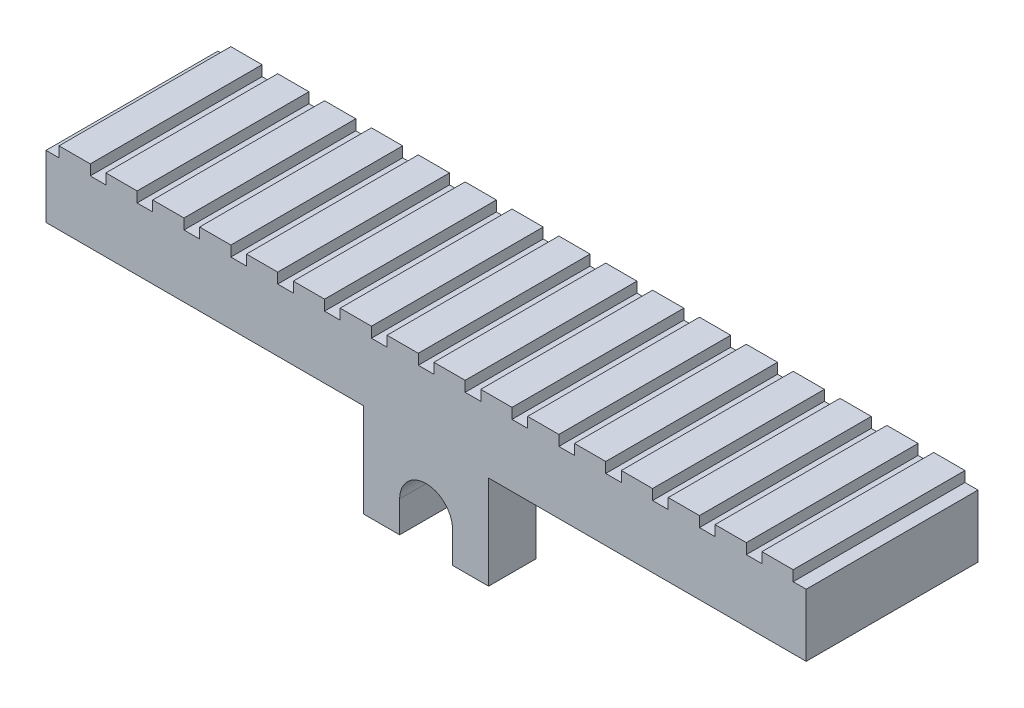
from build123d import *

# Parameters (mm, degrees)
SKETCH4_W            = 73
SKETCH4_H            = 15
BOSS_EXTRUDE4_DEPTH  = 6
SKETCH15_W           = 3
SKETCH15_H           = 15
BOSS_EXTRUDE6_DEPTH  = 1
BOSS_EXTRUDE7_DEPTH  = 1.5
BOSS_EXTRUDE13_DEPTH = 7.715
CUT_EXTRUDE2_REACH   = 40.656
SKETCH22_W           = 12
SKETCH22_H           = 3.715
CUT_EXTRUDE3_REACH   = 42.428
BOSS_EXTRUDE14_DEPTH = 2.54


with BuildPart() as part:
    # Sketch4 → Boss-Extrude4 (new body)
    with BuildSketch(Plane(origin=(0, 0, 0), x_dir=(-1, 0, 0), z_dir=(0, 1, 0))):
        Rectangle(SKETCH4_W, SKETCH4_H)
    extrude(amount=-BOSS_EXTRUDE4_DEPTH)

    # Sketch15 → Boss-Extrude6 (add)
    with BuildSketch(Plane(origin=(0, 0, 0), x_dir=(1, 0, 0), z_dir=(0, 1, 0))):
        with Locations((2.25, 0)):
            Rectangle(SKETCH15_W, SKETCH15_H)
        with Locations((6.75, 0)):
            Rectangle(SKETCH15_W, SKETCH15_H)
        with Locations((11.25, 0)):
            Rectangle(SKETCH15_W, SKETCH15_H)
        with Locations((15.75, 0)):
            Rectangle(SKETCH15_W, SKETCH15_H)
        with Locations((20.25, 0)):
            Rectangle(SKETCH15_W, SKETCH15_H)
        with Locations((24.75, 0)):
            Rectangle(SKETCH15_W, SKETCH15_H)
        with Locations((29.25, 0)):
            Rectangle(SKETCH15_W, SKETCH15_H)
        with Locations((33.75, 0)):
            Rectangle(SKETCH15_W, SKETCH15_H)
        with Locations((-33.75, 0)):
            Rectangle(SKETCH15_W, SKETCH15_H)
        with Locations((-29.25, 0)):
            Rectangle(SKETCH15_W, SKETCH15_H)
        with Locations((-24.75, 0)):
            Rectangle(SKETCH15_W, SKETCH15_H)
        with Locations((-20.25, 0)):
            Rectangle(SKETCH15_W, SKETCH15_H)
        with Locations((-15.75, 0)):
            Rectangle(SKETCH15_W, SKETCH15_H)
        with Locations((-11.25, 0)):
            Rectangle(SKETCH15_W, SKETCH15_H)
        with Locations((-6.75, 0)):
            Rectangle(SKETCH15_W, SKETCH15_H)
        with Locations((-2.25, 0)):
            Rectangle(SKETCH15_W, SKETCH15_H)
    extrude(amount=BOSS_EXTRUDE6_DEPTH)

    # Sketch16 → Boss-Extrude7 (add)
    with BuildSketch(Plane.XY.offset(7.5)):
        Polygon((-35.25, 0), (-36.5, 0), (-36.5, -6), (36.5, -6), (36.5, 0), (35.25, 0), (35.25, 1), (32.25, 1), (32.25, 0), (30.75, 0), (30.75, 1), (27.75, 1), (27.75, 0), (26.25, 0), (26.25, 1), (23.25, 1), (23.25, 0), (21.75, 0), (21.75, 1), (18.75, 1), (18.75, 0), (17.25, 0), (17.25, 1), (14.25, 1), (14.25, 0), (12.75, 0), (12.75, 1), (9.75, 1), (9.75, 0), (8.25, 0), (8.25, 1), (5.25, 1), (5.25, 0), (3.75, 0), (3.75, 1), (0.75, 1), (0.75, 0), (-0.75, 0), (-0.75, 1), (-3.75, 1), (-3.75, 0), (-5.25, 0), (-5.25, 1), (-8.25, 1), (-8.25, 0), (-9.75, 0), (-9.75, 1), (-12.75, 1), (-12.75, 0), (-14.25, 0), (-14.25, 1), (-17.25, 1), (-17.25, 0), (-18.75, 0), (-18.75, 1), (-21.75, 1), (-21.75, 0), (-23.25, 0), (-23.25, 1), (-26.25, 1), (-26.25, 0), (-27.75, 0), (-27.75, 1), (-30.75, 1), (-30.75, 0), (-32.25, 0), (-32.25, 1), (-35.25, 1), align=None)
    extrude(amount=BOSS_EXTRUDE7_DEPTH)

    # Sketch21 → Boss-Extrude13 (add)
    with BuildSketch(Plane.XY.offset(9)):
        with BuildLine():
            Line((-2.54, -12), (-2.54, -15))
            Line((-2.54, -15), (-6, -15))
            Line((-6, -15), (-6, -6))
            Line((-6, -6), (6, -6))
            Line((6, -6), (6, -15))
            Line((6, -15), (2.54, -15))
            Line((2.54, -15), (2.54, -12))
            ThreePointArc((2.54, -12), (0, -9.46), (-2.54, -12))
        make_face()
    extrude(amount=-BOSS_EXTRUDE13_DEPTH)

    # Cut-Extrude2: up to this face of the body (flat: up to its plane)
    cut_extrude2_end = Plane(part.part.faces().sort_by_distance((4.27, -15, 5.1425))[0])
    # Sketch22 → Cut-Extrude2 (cut, up to the picked face)
    with BuildSketch(Plane.XZ.offset(6), mode=Mode.PRIVATE) as cut_extrude2_sk1:
        with Locations((0, 5.1425)):
            Rectangle(SKETCH22_W, SKETCH22_H)
    cut_extrude2_tool1 = split(extrude(cut_extrude2_sk1.sketch, amount=CUT_EXTRUDE2_REACH, mode=Mode.PRIVATE), bisect_by=cut_extrude2_end, keep=Keep.BOTH, mode=Mode.PRIVATE)
    add(cut_extrude2_tool1.solids().sort_by(Axis((0, -6, 5.1425), (0, -1, 0)))[0], mode=Mode.SUBTRACT)

    # Sketch23 → Cut-Extrude3 (cut, up to next)
    with BuildSketch(Plane(origin=(0, 0, 1.285), x_dir=(-1, 0, 0), z_dir=(0, 0, -1)), mode=Mode.PRIVATE) as cut_extrude3_sk1:
        with BuildLine():
            Line((6, -15), (6, -6))
            Line((6, -6), (-6, -6))
            Line((-6, -6), (-6, -15))
            Line((-6, -15), (-2.54, -15))
            Line((-2.54, -15), (-2.54, -12))
            ThreePointArc((-2.54, -12), (0, -9.46), (2.54, -12))
            Line((2.54, -12), (2.54, -15))
            Line((2.54, -15), (6, -15))
        make_face()
    cut_extrude3_tool1 = extrude(cut_extrude3_sk1.sketch, amount=-CUT_EXTRUDE3_REACH, mode=Mode.PRIVATE) & part.part
    add(cut_extrude3_tool1.solids().sort_by_distance((-5.85, -10.5, 1.285))[0], mode=Mode.SUBTRACT)

    # Sketch24 → Boss-Extrude14 (add)
    with BuildSketch(Plane(origin=(0, 0, 7), x_dir=(-1, 0, 0), z_dir=(0, 0, -1))):
        with BuildLine():
            Line((2.54, -12), (2.54, -15))
            Line((2.54, -15), (6, -15))
            Line((6, -15), (6, -6))
            Line((6, -6), (-6, -6))
            Line((-6, -6), (-6, -15))
            Line((-6, -15), (-2.54, -15))
            Line((-2.54, -15), (-2.54, -12))
            ThreePointArc((-2.54, -12), (0, -9.46), (2.54, -12))
        make_face()
    extrude(amount=BOSS_EXTRUDE14_DEPTH)


solid = part.part
